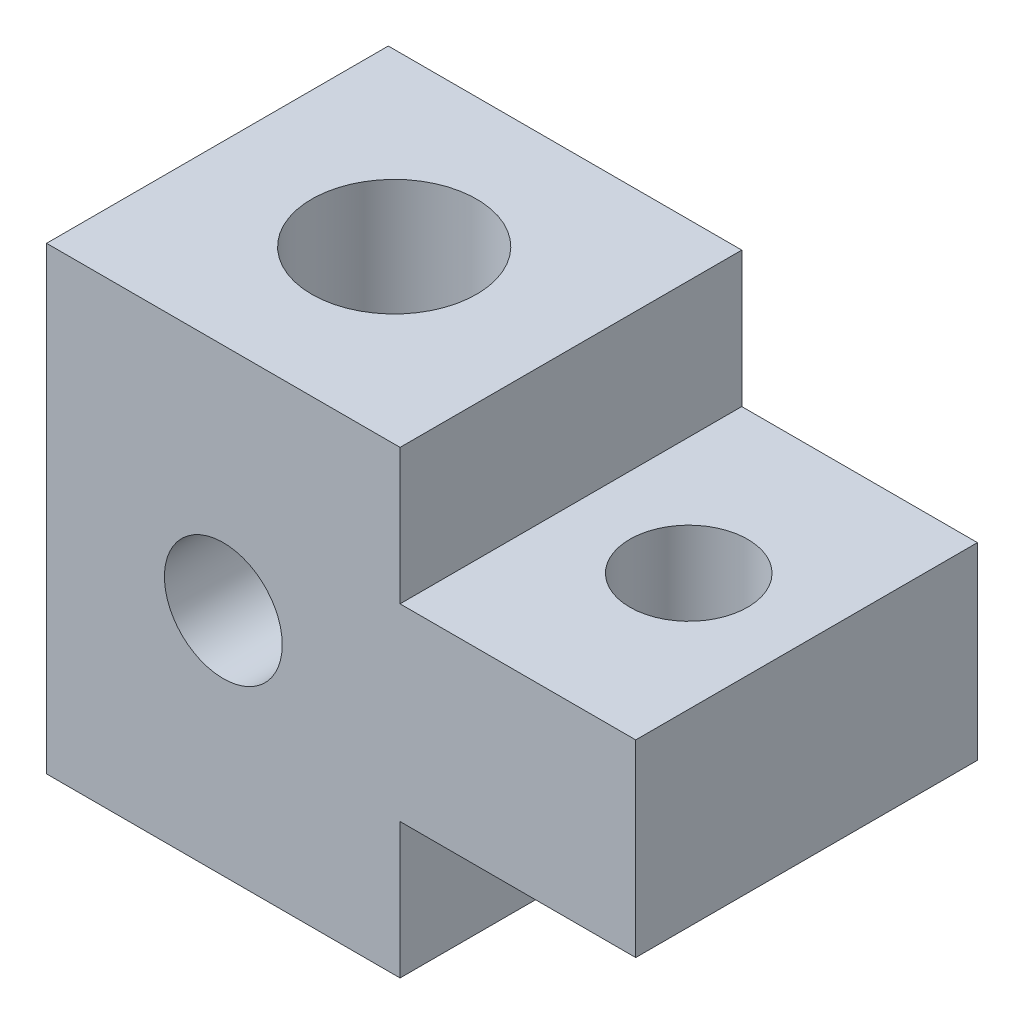
from build123d import *

# Parameters (mm, degrees)
ESQUISSE1_W             = 20
ESQUISSE1_H             = 8
BOSS_EXTRU_1_DEPTH      = 29
ESQUISSE2_R             = 7
ESQUISSE2_R_2           = 5
ENL_V_MAT_EXTRU_1_DEPTH = 70.728043139
ESQUISSE4_R             = 5
ENL_V_MAT_EXTRU_2_DEPTH = 62.002049146


with BuildPart() as part:
    # Esquisse1 → Boss.-Extru.1 (new body)
    with BuildSketch(Plane.XY):
        Polygon((0, 0), (30, 0), (30, 8), (30, 19.5), (0, 19.5), align=None)
        Polygon((30, -19.5), (30, -8), (30, 0), (0, 0), (0, -19.5), align=None)
        with Locations((40, -4)):
            Rectangle(ESQUISSE1_W, ESQUISSE1_H)
        with Locations((40, 4)):
            Rectangle(ESQUISSE1_W, ESQUISSE1_H)
    extrude(amount=BOSS_EXTRU_1_DEPTH)

    # Esquisse2 → Enlèv. mat.-Extru.1 (cut, through all)
    with BuildSketch(Plane(origin=(0, 19.5, 0), x_dir=(1, 0, 0), z_dir=(0, 1, 0))):
        with Locations(Location((15, -14.5, 0), (0, 0, 270))):
            Circle(ESQUISSE2_R)
        with Locations(Location((40, -14.5, 0), (0, 0, 270))):
            Circle(ESQUISSE2_R_2)
    extrude(amount=-ENL_V_MAT_EXTRU_1_DEPTH, mode=Mode.SUBTRACT)

    # Esquisse4 → Enlèv. mat.-Extru.2 (cut, through all)
    with BuildSketch(Plane.XY.offset(29)):
        with Locations((15, 0)):
            Circle(ESQUISSE4_R)
    extrude(amount=-ENL_V_MAT_EXTRU_2_DEPTH, mode=Mode.SUBTRACT)


solid = part.part
